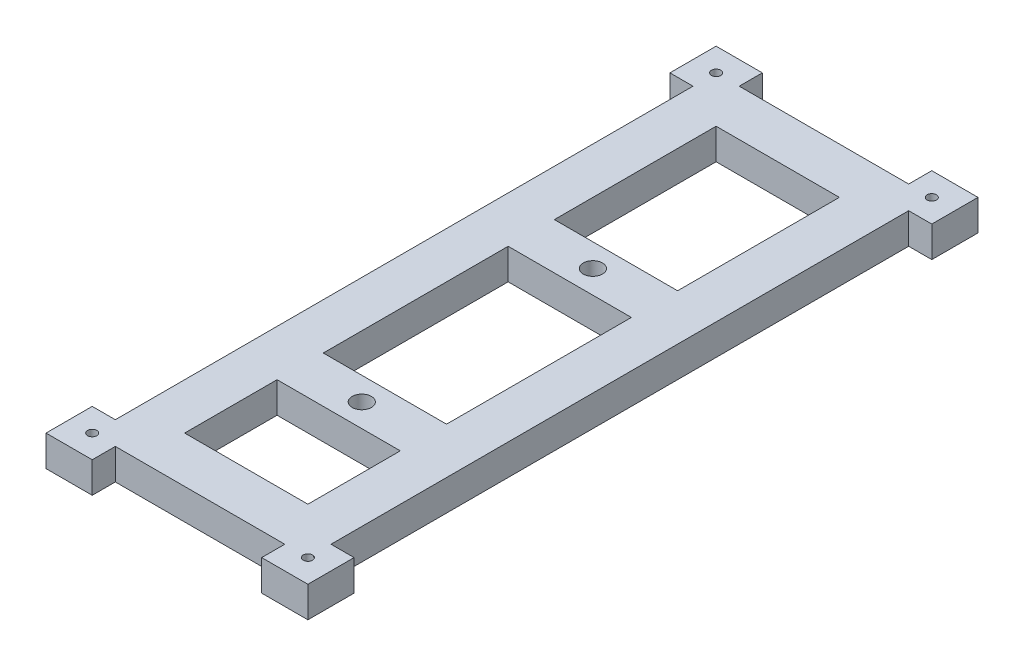
from build123d import *

# Parameters (mm, degrees)
SKETCH_1_W          = 34
SKETCH_1_H          = 87
SKETCH_1_R          = 0.6
EXTRUDE_1_DEPTH     = 4
SKETCH_2_W          = 22
SKETCH_2_H          = 3
SKETCH_2_W_2        = 3
SKETCH_2_H_2        = 75
SKETCH_2_W_3        = 16
SKETCH_2_H_3        = 21
SKETCH_2_R          = 1.25
SKETCH_2_H_4        = 12
SKETCH_2_H_5        = 24
CUT_EXTRUDE_1_DEPTH = 94.493315269
SKETCH_3_R          = 1.75
CUT_EXTRUDE_2_DEPTH = 2


with BuildPart() as part:
    # 草图1 → 凸台-拉伸1 (new body)
    with BuildSketch(Plane(origin=(0, 0, 0), x_dir=(1, 0, 0), z_dir=(0, 1, 0))):
        with Locations((17, -43.5)):
            Rectangle(SKETCH_1_W, SKETCH_1_H)
        with Locations(Location((3, -3, 0), (0, 0, 270))):
            Circle(SKETCH_1_R, mode=Mode.SUBTRACT)
        with Locations(Location((31, -3, 0), (0, 0, 270))):
            Circle(SKETCH_1_R, mode=Mode.SUBTRACT)
        with Locations(Location((31, -84, 0), (0, 0, 270))):
            Circle(SKETCH_1_R, mode=Mode.SUBTRACT)
        with Locations(Location((3, -84, 0), (0, 0, 270))):
            Circle(SKETCH_1_R, mode=Mode.SUBTRACT)
    extrude(amount=EXTRUDE_1_DEPTH)

    # 草图2 → 切除-拉伸1 (cut, through all)
    with BuildSketch(Plane(origin=(0, 4, 0), x_dir=(1, 0, 0), z_dir=(0, 1, 0))):
        with Locations((17, -1.5)):
            Rectangle(SKETCH_2_W, SKETCH_2_H)
        with Locations((1.5, -43.5)):
            Rectangle(SKETCH_2_W_2, SKETCH_2_H_2)
        with Locations((32.5, -43.5)):
            Rectangle(SKETCH_2_W_2, SKETCH_2_H_2)
        with Locations((17, -85.5)):
            Rectangle(SKETCH_2_W, SKETCH_2_H)
        with Locations((17, -19.5)):
            Rectangle(SKETCH_2_W_3, SKETCH_2_H_3)
        with Locations(Location((17, -33, 0), (0, 0, 270))):
            Circle(SKETCH_2_R)
        with Locations((17, -72)):
            Rectangle(SKETCH_2_W_3, SKETCH_2_H_4)
        with Locations(Location((17, -63, 0), (0, 0, 270))):
            Circle(SKETCH_2_R)
        with Locations((17, -48)):
            Rectangle(SKETCH_2_W_3, SKETCH_2_H_5)
    extrude(amount=-CUT_EXTRUDE_1_DEPTH, mode=Mode.SUBTRACT)

    # 草图3 → 切除-拉伸2 (cut)
    with BuildSketch(Plane.XZ):
        with Locations(Location((17, 63, 0), (0, 0, 270))):
            Circle(SKETCH_3_R)
        with Locations(Location((17, 33, 0), (0, 0, 270))):
            Circle(SKETCH_3_R)
    extrude(amount=-CUT_EXTRUDE_2_DEPTH, mode=Mode.SUBTRACT)


solid = part.part
